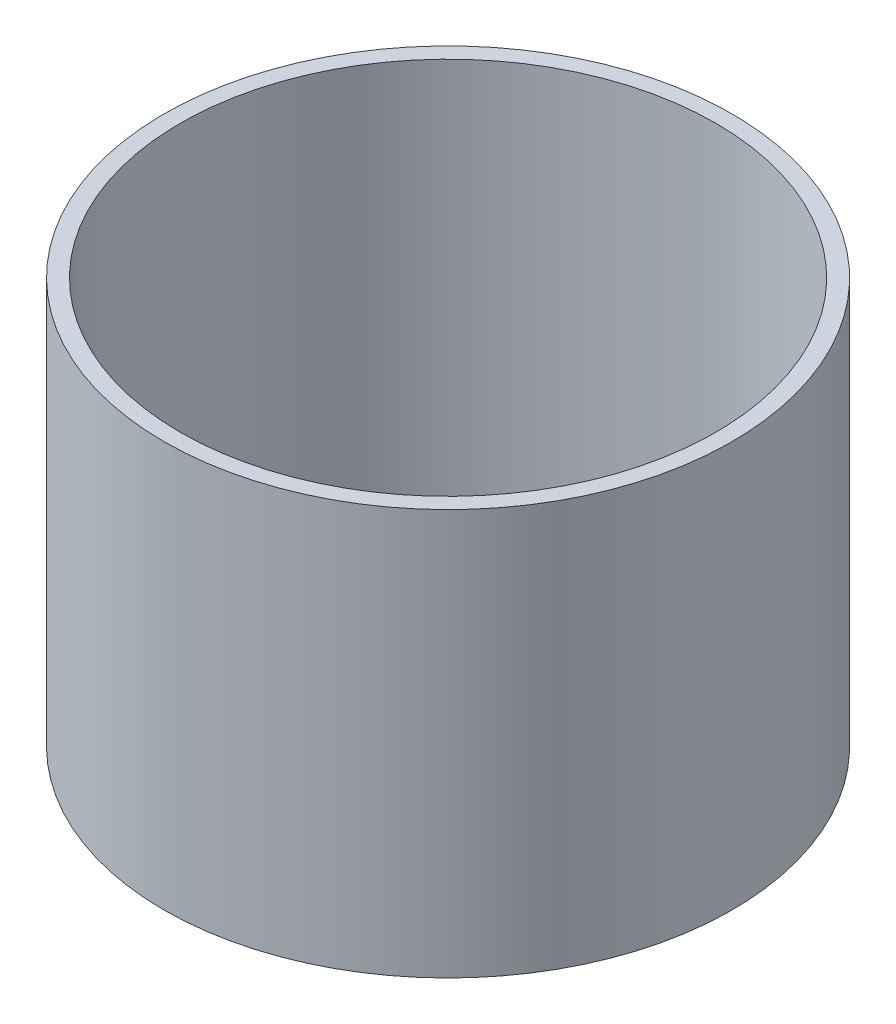
from build123d import *

# Parameters (mm, degrees)
SKETCH1_R           = 17.5
SKETCH1_R_2         = 16.5
BOSS_EXTRUDE1_DEPTH = 25


with BuildPart() as part:
    # Sketch1 → Boss-Extrude1 (new body)
    with BuildSketch(Plane(origin=(0, 0, 0), x_dir=(1, 0, 0), z_dir=(0, 1, 0))):
        with Locations(Location((0, 0, 0), (0, 0, 270))):
            Circle(SKETCH1_R)
        with Locations(Location((0, 0, 0), (0, 0, 270))):
            Circle(SKETCH1_R_2, mode=Mode.SUBTRACT)
    extrude(amount=BOSS_EXTRUDE1_DEPTH)


solid = part.part
